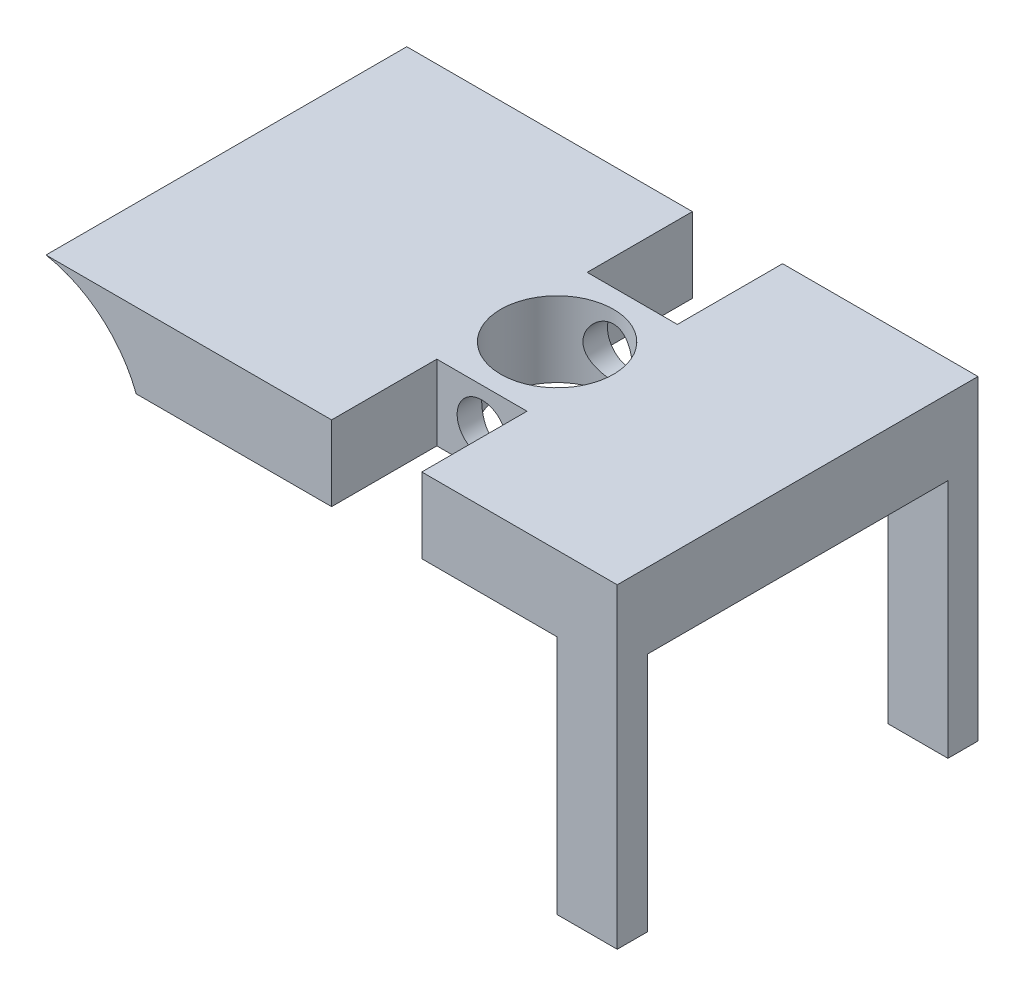
from build123d import *

# Parameters (mm, degrees)
BOSS_EXTRUDE1_DEPTH = 12
CUT_EXTRUDE1_REACH  = 32.712
SKETCH4_R           = 1.65
SKETCH4_3_W         = 6
SKETCH4_3_H         = 5
SKETCH4_3_R         = 1.65
CUT_EXTRUDE3_DEPTH  = 7
CUT_EXTRUDE2_REACH  = 25.022
SKETCH5_R           = 3.75
SKETCH6_W           = 4
SKETCH6_H           = 16
BOSS_EXTRUDE2_DEPTH = 24
CUT_EXTRUDE4_REACH  = 42.525
SKETCH7_W           = 20
SKETCH7_H           = 16


with BuildPart() as part:
    # Sketch3 → Boss-Extrude1 (new, symmetric)
    with BuildSketch(Plane.XY):
        with BuildLine():
            Line((-13, -2.5), (19, -2.5))
            Line((19, -2.5), (19, 2.5))
            Line((19, 2.5), (-19, 2.5))
            ThreePointArc((-19, 2.5), (-15.348369117, 0.781957059), (-13, -2.5))
        make_face()
    extrude(amount=BOSS_EXTRUDE1_DEPTH, both=True)

    # Sketch4 → Cut-Extrude1 (cut, up to next)
    with BuildSketch(Plane.XY.offset(12), mode=Mode.PRIVATE) as cut_extrude1_sk1:
        with Locations((3, 0)):
            Circle(SKETCH4_R)
    cut_extrude1_tool1 = extrude(cut_extrude1_sk1.sketch, amount=-CUT_EXTRUDE1_REACH, mode=Mode.PRIVATE) & part.part
    add(cut_extrude1_tool1.solids().sort_by_distance((3, 0, 12))[0], mode=Mode.SUBTRACT)

    # Sketch4<3> → Cut-Extrude3 (cut)
    with BuildSketch(Plane.XY.offset(12)):
        with Locations((3, 0)):
            Rectangle(SKETCH4_3_W, SKETCH4_3_H)
        with Locations((3, 0)):
            Circle(SKETCH4_3_R, mode=Mode.SUBTRACT)
    cut_extrude3 = extrude(amount=-CUT_EXTRUDE3_DEPTH, mode=Mode.SUBTRACT)

    # Mirror1: Cut-Extrude3 across plane
    add(cut_extrude3.mirror(Plane.XY), mode=Mode.SUBTRACT)

    # Sketch5 → Cut-Extrude2 (cut, up to next)
    with BuildSketch(Plane(origin=(0, 2.5, 0), x_dir=(1, 0, 0), z_dir=(0, 1, 0)), mode=Mode.PRIVATE) as cut_extrude2_sk1:
        with Locations(Location((3, 0, 0), (0, 0, 270))):
            Circle(SKETCH5_R)
    cut_extrude2_tool1 = extrude(cut_extrude2_sk1.sketch, amount=-CUT_EXTRUDE2_REACH, mode=Mode.PRIVATE) & part.part
    add(cut_extrude2_tool1.solids().sort_by_distance((3, 2.5, 0))[0], mode=Mode.SUBTRACT)

    # Sketch6 → Boss-Extrude2 (add)
    with BuildSketch(Plane.XY.offset(12)):
        with Locations((17, -10.5)):
            Rectangle(SKETCH6_W, SKETCH6_H)
    extrude(amount=-BOSS_EXTRUDE2_DEPTH)

    # Sketch7 → Cut-Extrude4 (cut, up to next)
    with BuildSketch(Plane.ZY.offset(-15), mode=Mode.PRIVATE) as cut_extrude4_sk1:
        with Locations((0, -10.5)):
            Rectangle(SKETCH7_W, SKETCH7_H)
    cut_extrude4_tool1 = extrude(cut_extrude4_sk1.sketch, amount=-CUT_EXTRUDE4_REACH, mode=Mode.PRIVATE) & part.part
    add(cut_extrude4_tool1.solids().sort_by_distance((15, -10.5, 0))[0], mode=Mode.SUBTRACT)


solid = part.part
